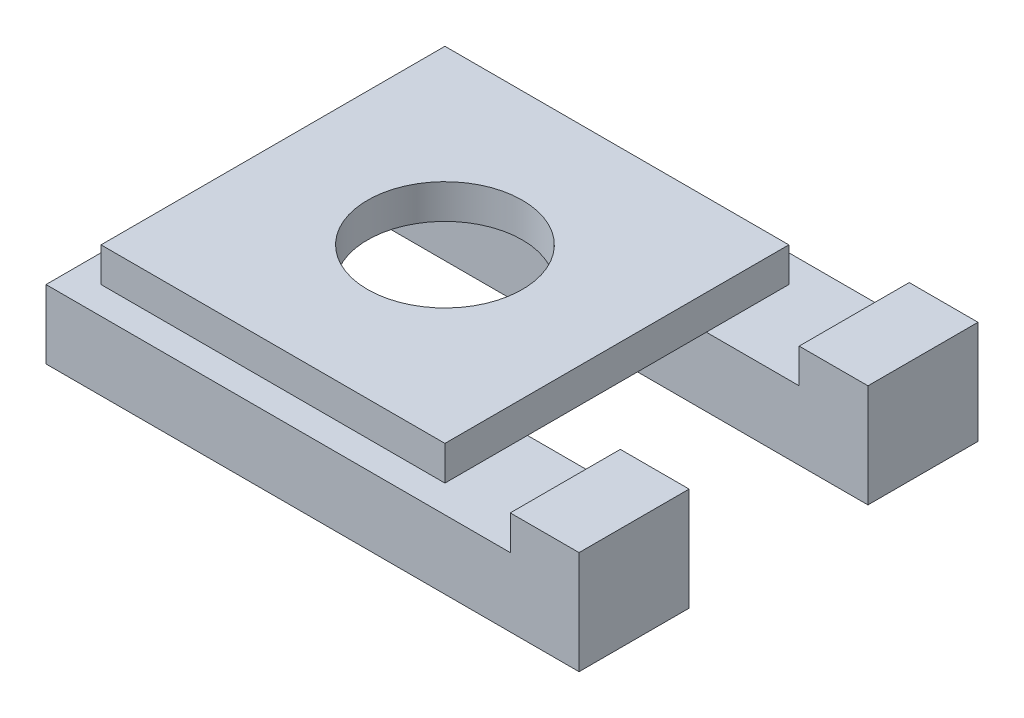
from build123d import *

# Parameters (mm, degrees)
SKETCH2_W             = 100
SKETCH2_H             = 100
SKETCH2_R             = 22.5
BOSS_EXTRUDE1_DEPTH   = 10
SKETCH2_W_2           = 20
SKETCH2_H_2           = 32
BOSS_EXTRUDE1_2_DEPTH = 10
BOSS_EXTRUDE1_3_DEPTH = 10
BOSS_EXTRUDE2_DEPTH   = 20
SKETCH2_5_W           = 100
SKETCH2_5_H           = 24
BOSS_EXTRUDE3_DEPTH   = 20


with BuildPart() as part:
    # Sketch2 → Boss-Extrude1 (new body)
    with BuildSketch(Plane(origin=(0, 0, 0), x_dir=(1, 0, 0), z_dir=(0, 1, 0))):
        Rectangle(SKETCH2_W, SKETCH2_H)
        Circle(SKETCH2_R, mode=Mode.SUBTRACT)
    extrude(amount=BOSS_EXTRUDE1_DEPTH)



with BuildPart() as body_2:
    # Sketch2 → Boss-Extrude1 2 (new body)
    with BuildSketch(Plane(origin=(0, 0, 0), x_dir=(1, 0, 0), z_dir=(0, 1, 0))):
        with Locations((87, 42)):
            Rectangle(SKETCH2_W_2, SKETCH2_H_2)
    extrude(amount=BOSS_EXTRUDE1_2_DEPTH)



with BuildPart() as body_3:
    # Sketch2 → Boss-Extrude1 3 (new body)
    with BuildSketch(Plane(origin=(0, 0, 0), x_dir=(1, 0, 0), z_dir=(0, 1, 0))):
        with Locations((87, -42)):
            Rectangle(SKETCH2_W_2, SKETCH2_H_2)
    extrude(amount=BOSS_EXTRUDE1_3_DEPTH)


with BuildPart() as body_2_1:
    add(body_2.part)

    add(body_3.part)  # Boss-Extrude2 merges body 3
    # Sketch2<4> → Boss-Extrude2 (add)
    with BuildSketch(Plane(origin=(0, 0, 0), x_dir=(1, 0, 0), z_dir=(0, 1, 0))):
        Polygon((-50, 26), (-50, 50), (50, 50), (50, 26), (97, 26), (97, 58), (-58, 58), (-58, 26), align=None)
        Polygon((-50, -50), (-50, -26), (-58, -26), (-58, -58), (97, -58), (97, -26), (50, -26), (50, -50), align=None)
    extrude(amount=-BOSS_EXTRUDE2_DEPTH)


with BuildPart() as part_1:
    add(part.part)

    add(body_2_1.part)  # Boss-Extrude3 merges body 2
    # Sketch2<5> → Boss-Extrude3 (add)
    with BuildSketch(Plane(origin=(0, 0, 0), x_dir=(1, 0, 0), z_dir=(0, 1, 0))):
        with Locations((0, 38)):
            Rectangle(SKETCH2_5_W, SKETCH2_5_H)
        with Locations((0, -38)):
            Rectangle(SKETCH2_5_W, SKETCH2_5_H)
    extrude(amount=-BOSS_EXTRUDE3_DEPTH)


solid = part_1.part
